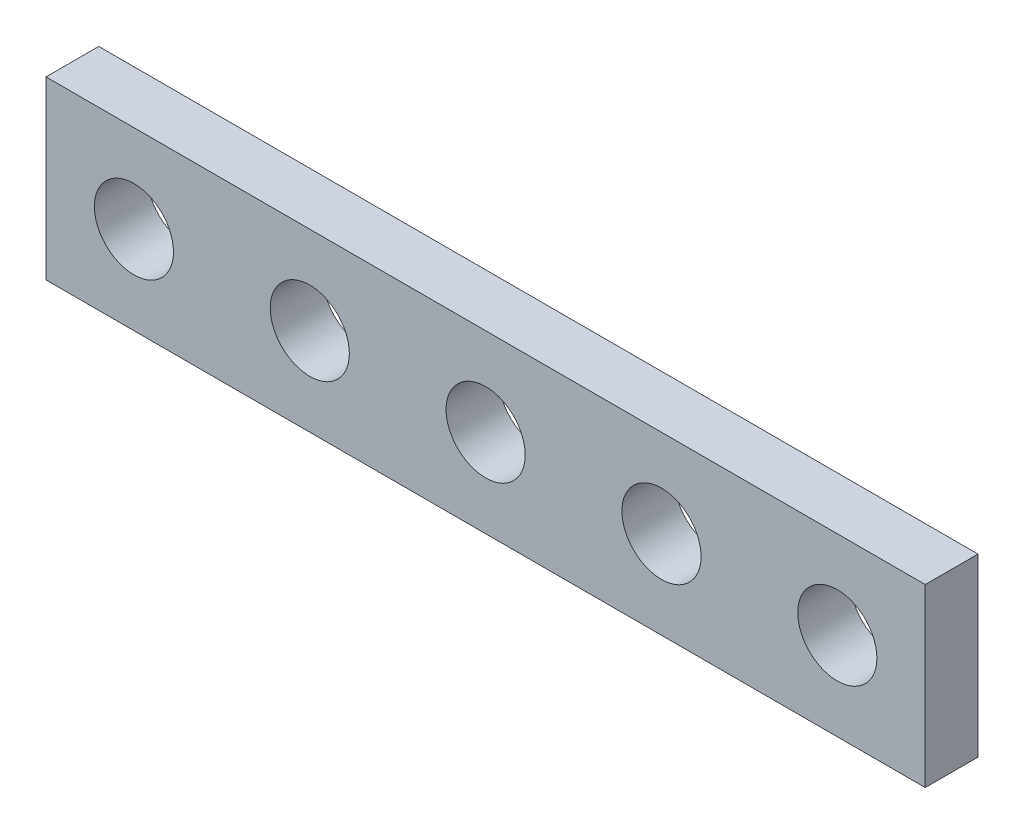
from build123d import *

# Parameters (mm, degrees)
CROQUIS1_W              = 50
CROQUIS1_H              = 10
SALIENTE_EXTRUIR1_DEPTH = 3
CROQUIS2_R              = 2.25
CORTAR_EXTRUIR1_DEPTH   = 52.078371156


with BuildPart() as part:
    # Croquis1 → Saliente-Extruir1 (new body)
    with BuildSketch(Plane.XY):
        with Locations((25, 5)):
            Rectangle(CROQUIS1_W, CROQUIS1_H)
    extrude(amount=SALIENTE_EXTRUIR1_DEPTH)

    # Croquis2 → Cortar-Extruir1 (cut, through all)
    with BuildSketch(Plane.XY.offset(3)):
        with Locations((5, 5)):
            Circle(CROQUIS2_R)
        with Locations((15, 5)):
            Circle(CROQUIS2_R)
        with Locations((25, 5)):
            Circle(CROQUIS2_R)
        with Locations((35, 5)):
            Circle(CROQUIS2_R)
        with Locations((45, 5)):
            Circle(CROQUIS2_R)
    extrude(amount=-CORTAR_EXTRUIR1_DEPTH, mode=Mode.SUBTRACT)


solid = part.part
